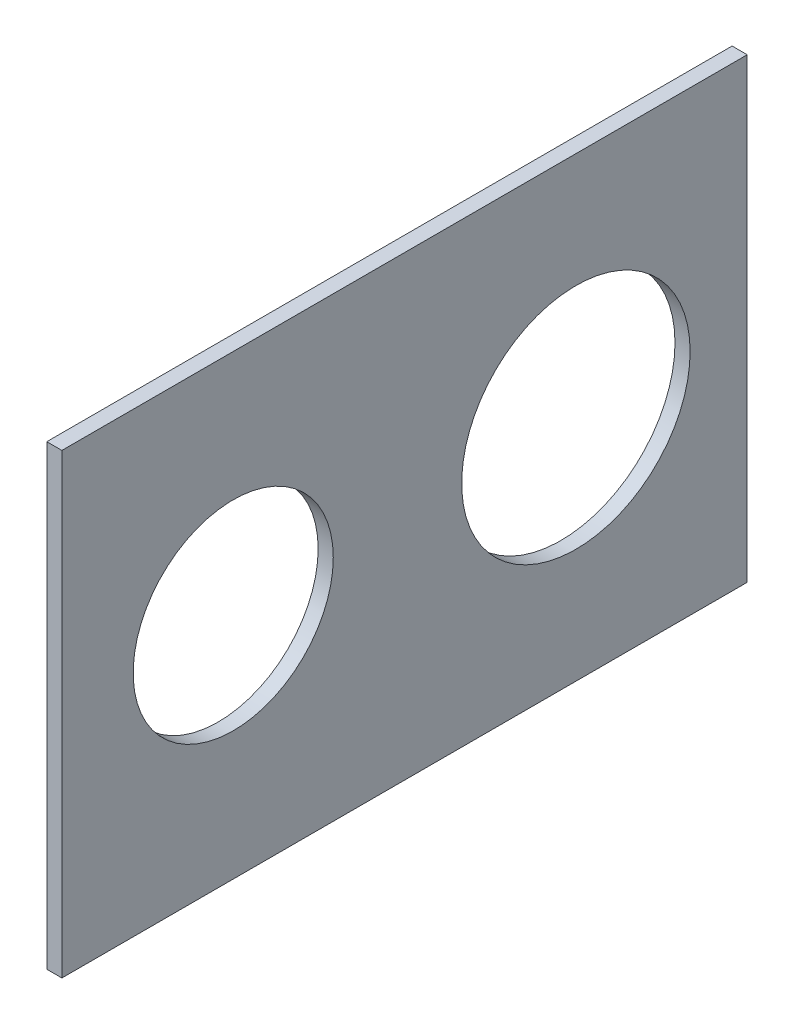
from build123d import *

# Parameters (mm, degrees)
SKETCH1_W           = 50.8
SKETCH1_H           = 76.2
BOSS_EXTRUDE1_DEPTH = 1.681219215
SKETCH3_R           = 11.1252
SKETCH3_R_2         = 12.7
CUT_EXTRUDE1_DEPTH  = 92.59643278


with BuildPart() as part:
    # Sketch1 → Boss-Extrude1 (new body)
    with BuildSketch(Plane.YZ):
        with Locations((25.4, 38.1)):
            Rectangle(SKETCH1_W, SKETCH1_H)
    extrude(amount=BOSS_EXTRUDE1_DEPTH)

    # Sketch3 → Cut-Extrude1 (cut, through all)
    with BuildSketch(Plane.YZ.offset(1.681219215)):
        with Locations(Location((25.4, 57.15, 0), (0, 0, 270))):
            Circle(SKETCH3_R)
        with Locations(Location((25.4, 19.05, 0), (0, 0, 270))):
            Circle(SKETCH3_R_2)
    extrude(amount=-CUT_EXTRUDE1_DEPTH, mode=Mode.SUBTRACT)


solid = part.part
